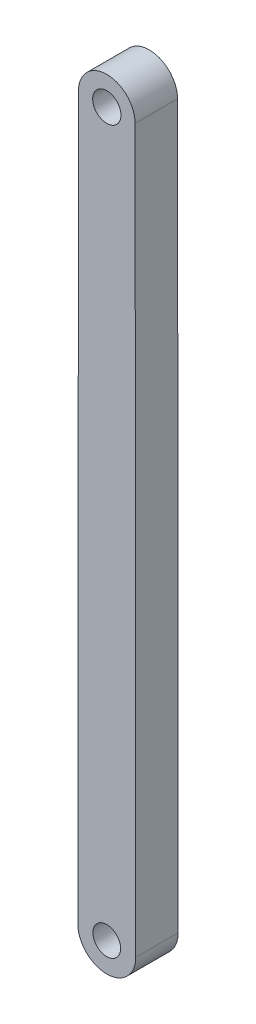
from build123d import *

# Parameters (mm, degrees)
SKETCH_1_R      = 1
SKETCH_1_R_2    = 0.980392254
EXTRUDE_1_DEPTH = 3


with BuildPart() as part:
    # 草图1 → 凸台-拉伸1 (new body)
    with BuildSketch(Plane.XY):
        with BuildLine():
            Line((-427.923536292, 34.46813475), (-427.968679133, 85.468092925))
            ThreePointArc((-427.968679133, 85.468092925), (-429.968595648, 87.466322615), (-431.968677413, 85.468258328))
            Line((-431.968677413, 85.468258328), (-432.018038024, 34.468304061))
            ThreePointArc((-432.018038024, 34.468304061), (-429.970871892, 32.419070873), (-427.923536292, 34.46813475))
        make_face()
        with Locations((-429.96867835, 85.466322617)):
            Circle(SKETCH_1_R, mode=Mode.SUBTRACT)
        with Locations((-429.970787236, 34.466322617)):
            Circle(SKETCH_1_R_2, mode=Mode.SUBTRACT)
    extrude(amount=EXTRUDE_1_DEPTH)


solid = part.part
